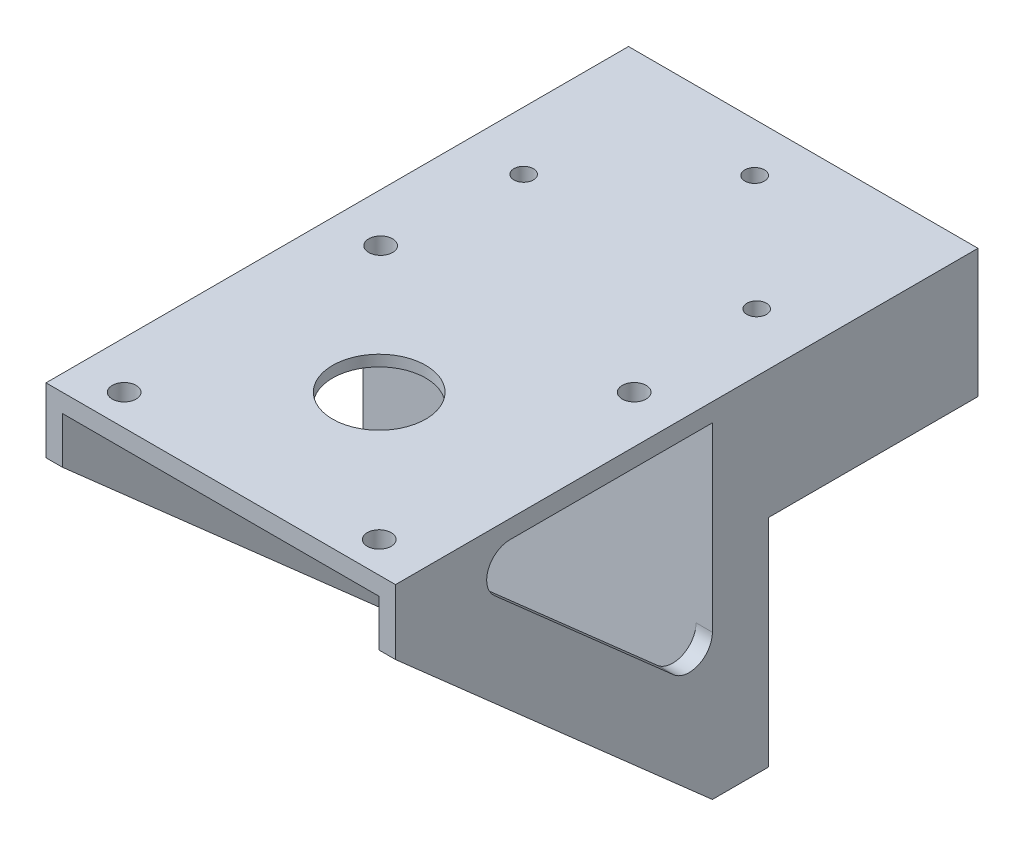
from build123d import *

# Parameters (mm, degrees)
SKETCH1_W                      = 95.25
SKETCH1_H                      = 63.5
SKETCH1_H_2                    = 95.25
BOSS_EXTRUDE1_DEPTH            = 5
BOSS_EXTRUDE2_DEPTH            = 88.9
CUT_EXTRUDE1_REACH             = 170.812
CUT_EXTRUDE1_DIRECTION_2_REACH = 170.812
SKETCH4_R                      = 37.5
CUT_EXTRUDE2_DEPTH             = 2
CUT_EXTRUDE3_REACH             = 170.812
CUT_EXTRUDE3_DIRECTION_2_REACH = 170.812
FILLET1_R                      = 6.35
SKETCH6_W                      = 95.25
SKETCH6_H                      = 57.15
BOSS_EXTRUDE3_DEPTH            = 30
CUT_EXTRUDE4_REACH             = 136.485
SKETCH7_R                      = 2.665000004
CUT_EXTRUDE5_REACH             = 155.082
SKETCH8_R                      = 12.7
CUT_EXTRUDE6_REACH             = 152.067
SKETCH9_R                      = 3.25


with BuildPart() as part:
    # Sketch1 → Boss-Extrude1 (new body)
    with BuildSketch(Plane(origin=(0, 0, 0), x_dir=(1, 0, 0), z_dir=(0, 1, 0))):
        with Locations((0, 79.375)):
            Rectangle(SKETCH1_W, SKETCH1_H)
        Rectangle(SKETCH1_W, SKETCH1_H_2)
    extrude(amount=BOSS_EXTRUDE1_DEPTH)

    # Sketch2 → Boss-Extrude2 (add)
    with BuildSketch(Plane(origin=(0, 0, 0), x_dir=(-1, 0, 0), z_dir=(0, -1, 0))):
        Polygon((43.18, 38.735), (43.18, -47.625), (47.625, -47.625), (47.625, 53.975), (-47.625, 53.975), (-47.625, -47.625), (-43.18, -47.625), (-43.18, 38.735), align=None)
    extrude(amount=BOSS_EXTRUDE2_DEPTH)

    # Sketch3 → Cut-Extrude1 (cut, up to next)
    with BuildSketch(Plane.ZY.offset(-43.18), mode=Mode.PRIVATE) as cut_extrude1_sk1:
        Polygon((-38.735, -88.9), (47.625, -12.7), (47.625, -88.9), align=None)
    cut_extrude1_tool1 = extrude(cut_extrude1_sk1.sketch, amount=-CUT_EXTRUDE1_REACH, mode=Mode.PRIVATE) & part.part
    add(cut_extrude1_tool1.solids().sort_by_distance((43.18, -63.5, 18.838333))[0], mode=Mode.SUBTRACT)

    # Sketch3 → Cut-Extrude1 direction 2 (cut, up to next)
    with BuildSketch(Plane.ZY.offset(-43.18), mode=Mode.PRIVATE) as cut_extrude1_direction_2_sk1:
        Polygon((-38.735, -88.9), (47.625, -12.7), (47.625, -88.9), align=None)
    cut_extrude1_direction_2_tool1 = extrude(cut_extrude1_direction_2_sk1.sketch, amount=CUT_EXTRUDE1_DIRECTION_2_REACH, mode=Mode.PRIVATE) & part.part
    add(cut_extrude1_direction_2_tool1.solids().sort_by_distance((43.18, -63.5, 18.838333))[0], mode=Mode.SUBTRACT)

    # Sketch4 → Cut-Extrude2 (cut)
    with BuildSketch(Plane(origin=(0, 0, 0), x_dir=(-1, 0, 0), z_dir=(0, -1, 0))):
        with Locations(Location((0, -4.445, 0), (0, 0, 90))):
            Circle(SKETCH4_R)
    extrude(amount=-CUT_EXTRUDE2_DEPTH, mode=Mode.SUBTRACT)

    # Sketch5 → Cut-Extrude3 (cut, up to next)
    with BuildSketch(Plane(origin=(-43.18, 0, 0), x_dir=(0, 0, -1), z_dir=(1, 0, 0)), mode=Mode.PRIVATE) as cut_extrude3_sk1:
        Polygon((38.735, 0), (-33.225441849, 0), (38.735, -63.494507514), align=None)
    cut_extrude3_tool1 = extrude(cut_extrude3_sk1.sketch, amount=-CUT_EXTRUDE3_REACH, mode=Mode.PRIVATE) & part.part
    add(cut_extrude3_tool1.solids().sort_by_distance((-43.18, -21.164836, -14.748186))[0], mode=Mode.SUBTRACT)

    # Sketch5 → Cut-Extrude3 direction 2 (cut, up to next)
    with BuildSketch(Plane(origin=(-43.18, 0, 0), x_dir=(0, 0, -1), z_dir=(1, 0, 0)), mode=Mode.PRIVATE) as cut_extrude3_direction_2_sk1:
        Polygon((38.735, 0), (-33.225441849, 0), (38.735, -63.494507514), align=None)
    cut_extrude3_direction_2_tool1 = extrude(cut_extrude3_direction_2_sk1.sketch, amount=CUT_EXTRUDE3_DIRECTION_2_REACH, mode=Mode.PRIVATE) & part.part
    add(cut_extrude3_direction_2_tool1.solids().sort_by_distance((-43.18, -21.164836, -14.748186))[0], mode=Mode.SUBTRACT)

    # Fillet1
    fillet1_edges = [part.edges().sort_by_distance(p)[0] for p in [
        (45.4025, -63.494507514, -38.735),
        (45.4025, 0, 33.225441849),
        (-45.4025, 0, 33.225441849),
        (-45.4025, -63.494507514, -38.735),
    ]]
    fillet(fillet1_edges, radius=FILLET1_R)

    # Sketch6 → Boss-Extrude3 (add)
    with BuildSketch(Plane.XZ):
        with Locations((0, -82.55)):
            Rectangle(SKETCH6_W, SKETCH6_H)
    extrude(amount=BOSS_EXTRUDE3_DEPTH)

    # Sketch7 → Cut-Extrude4 (cut, up to next)
    with BuildSketch(Plane(origin=(0, -30, 0), x_dir=(-1, 0, 0), z_dir=(0, -1, 0)), mode=Mode.PRIVATE) as cut_extrude4_sk1:
        with Locations(Location((0, 97.872945695, 0), (0, 0, 90))):
            Circle(SKETCH7_R)
    cut_extrude4_tool1 = extrude(cut_extrude4_sk1.sketch, amount=-CUT_EXTRUDE4_REACH, mode=Mode.PRIVATE) & part.part
    # Sketch7 → Cut-Extrude4 (cut, up to next)
    with BuildSketch(Plane(origin=(0, -30, 0), x_dir=(-1, 0, 0), z_dir=(0, -1, 0)), mode=Mode.PRIVATE) as cut_extrude4_sk2:
        with Locations(Location((31.75, 66.675, 0), (0, 0, 90))):
            Circle(SKETCH7_R)
    cut_extrude4_tool2 = extrude(cut_extrude4_sk2.sketch, amount=-CUT_EXTRUDE4_REACH, mode=Mode.PRIVATE) & part.part
    # Sketch7 → Cut-Extrude4 (cut, up to next)
    with BuildSketch(Plane(origin=(0, -30, 0), x_dir=(-1, 0, 0), z_dir=(0, -1, 0)), mode=Mode.PRIVATE) as cut_extrude4_sk3:
        with Locations(Location((-31.75, 66.675, 0), (0, 0, 90))):
            Circle(SKETCH7_R)
    cut_extrude4_tool3 = extrude(cut_extrude4_sk3.sketch, amount=-CUT_EXTRUDE4_REACH, mode=Mode.PRIVATE) & part.part
    add(cut_extrude4_tool1.solids().sort_by_distance((0, -30, -97.872946))[0], mode=Mode.SUBTRACT)
    add(cut_extrude4_tool2.solids().sort_by_distance((-31.75, -30, -66.675))[0], mode=Mode.SUBTRACT)
    add(cut_extrude4_tool3.solids().sort_by_distance((31.75, -30, -66.675))[0], mode=Mode.SUBTRACT)

    # Sketch8 → Cut-Extrude5 (cut, up to next)
    with BuildSketch(Plane(origin=(0, 5, 0), x_dir=(1, 0, 0), z_dir=(0, 1, 0)), mode=Mode.PRIVATE) as cut_extrude5_sk1:
        with Locations(Location((0, -4.445, 0), (0, 0, 270))):
            Circle(SKETCH8_R)
    cut_extrude5_tool1 = extrude(cut_extrude5_sk1.sketch, amount=-CUT_EXTRUDE5_REACH, mode=Mode.PRIVATE) & part.part
    add(cut_extrude5_tool1.solids().sort_by_distance((0, 5, 4.445))[0], mode=Mode.SUBTRACT)

    # Sketch9 → Cut-Extrude6 (cut, up to next)
    with BuildSketch(Plane(origin=(0, 0, 0), x_dir=(-1, 0, 0), z_dir=(0, -1, 0)), mode=Mode.PRIVATE) as cut_extrude6_sk1:
        with Locations(Location((34.75, -39.195, 0), (0, 0, 90))):
            Circle(SKETCH9_R)
    cut_extrude6_tool1 = extrude(cut_extrude6_sk1.sketch, amount=-CUT_EXTRUDE6_REACH, mode=Mode.PRIVATE) & part.part
    # Sketch9 → Cut-Extrude6 (cut, up to next)
    with BuildSketch(Plane(origin=(0, 0, 0), x_dir=(-1, 0, 0), z_dir=(0, -1, 0)), mode=Mode.PRIVATE) as cut_extrude6_sk2:
        with Locations(Location((-34.75, -39.195, 0), (0, 0, 90))):
            Circle(SKETCH9_R)
    cut_extrude6_tool2 = extrude(cut_extrude6_sk2.sketch, amount=-CUT_EXTRUDE6_REACH, mode=Mode.PRIVATE) & part.part
    # Sketch9 → Cut-Extrude6 (cut, up to next)
    with BuildSketch(Plane(origin=(0, 0, 0), x_dir=(-1, 0, 0), z_dir=(0, -1, 0)), mode=Mode.PRIVATE) as cut_extrude6_sk3:
        with Locations(Location((34.396603139, 30.34702737, 0), (0, 0, 90))):
            Circle(SKETCH9_R)
    cut_extrude6_tool3 = extrude(cut_extrude6_sk3.sketch, amount=-CUT_EXTRUDE6_REACH, mode=Mode.PRIVATE) & part.part
    # Sketch9 → Cut-Extrude6 (cut, up to next)
    with BuildSketch(Plane(origin=(0, 0, 0), x_dir=(-1, 0, 0), z_dir=(0, -1, 0)), mode=Mode.PRIVATE) as cut_extrude6_sk4:
        with Locations(Location((-34.75, 30.305, 0), (0, 0, 90))):
            Circle(SKETCH9_R)
    cut_extrude6_tool4 = extrude(cut_extrude6_sk4.sketch, amount=-CUT_EXTRUDE6_REACH, mode=Mode.PRIVATE) & part.part
    add(cut_extrude6_tool1.solids().sort_by_distance((-34.75, 0, 39.195))[0], mode=Mode.SUBTRACT)
    add(cut_extrude6_tool2.solids().sort_by_distance((34.75, 0, 39.195))[0], mode=Mode.SUBTRACT)
    add(cut_extrude6_tool3.solids().sort_by_distance((-34.396603, 0, -30.347027))[0], mode=Mode.SUBTRACT)
    add(cut_extrude6_tool4.solids().sort_by_distance((34.75, 0, -30.305))[0], mode=Mode.SUBTRACT)


solid = part.part
